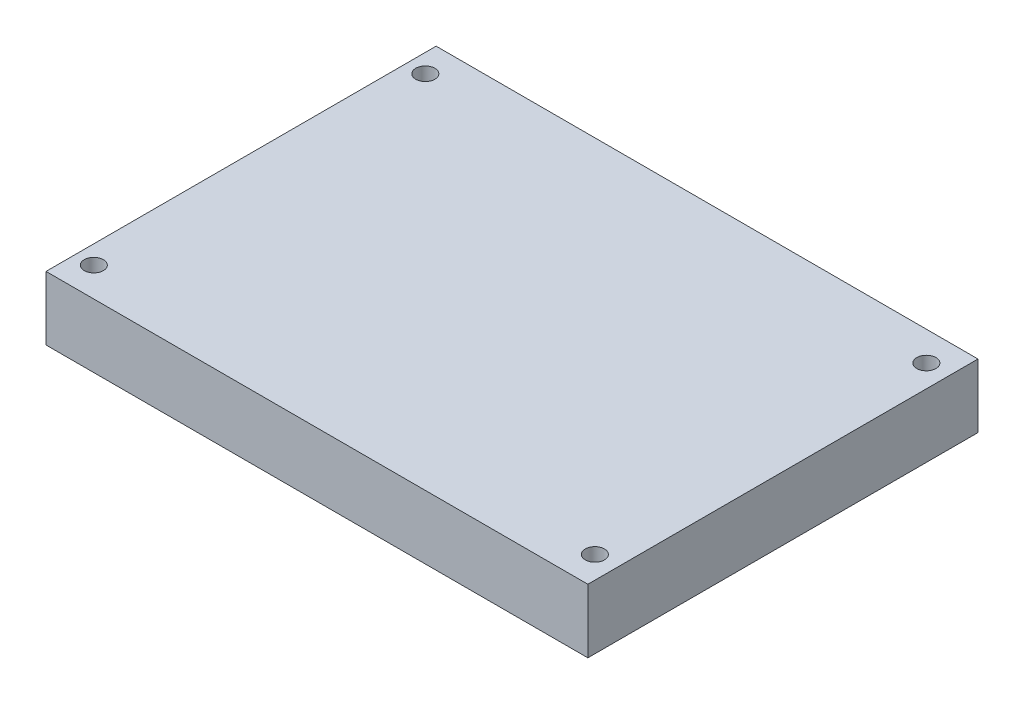
from build123d import *

# Parameters (mm, degrees)
SKETCH_1_W      = 85
SKETCH_1_H      = 61.2
SKETCH_1_R      = 1.5
EXTRUDE_1_DEPTH = 10


with BuildPart() as part:
    # 草图1 → 凸台-拉伸1 (new body)
    with BuildSketch(Plane(origin=(0, 0, 0), x_dir=(1, 0, 0), z_dir=(0, 1, 0))):
        Rectangle(SKETCH_1_W, SKETCH_1_H)
        with Locations(Location((-39.6, 26, 0), (0, 0, 270))):
            Circle(SKETCH_1_R, mode=Mode.SUBTRACT)
        with Locations(Location((39, 26, 0), (0, 0, 270))):
            Circle(SKETCH_1_R, mode=Mode.SUBTRACT)
        with Locations(Location((39, -26, 0), (0, 0, 90))):
            Circle(SKETCH_1_R, mode=Mode.SUBTRACT)
        with Locations(Location((-39.6, -26, 0), (0, 0, 90))):
            Circle(SKETCH_1_R, mode=Mode.SUBTRACT)
    extrude(amount=EXTRUDE_1_DEPTH)


solid = part.part
